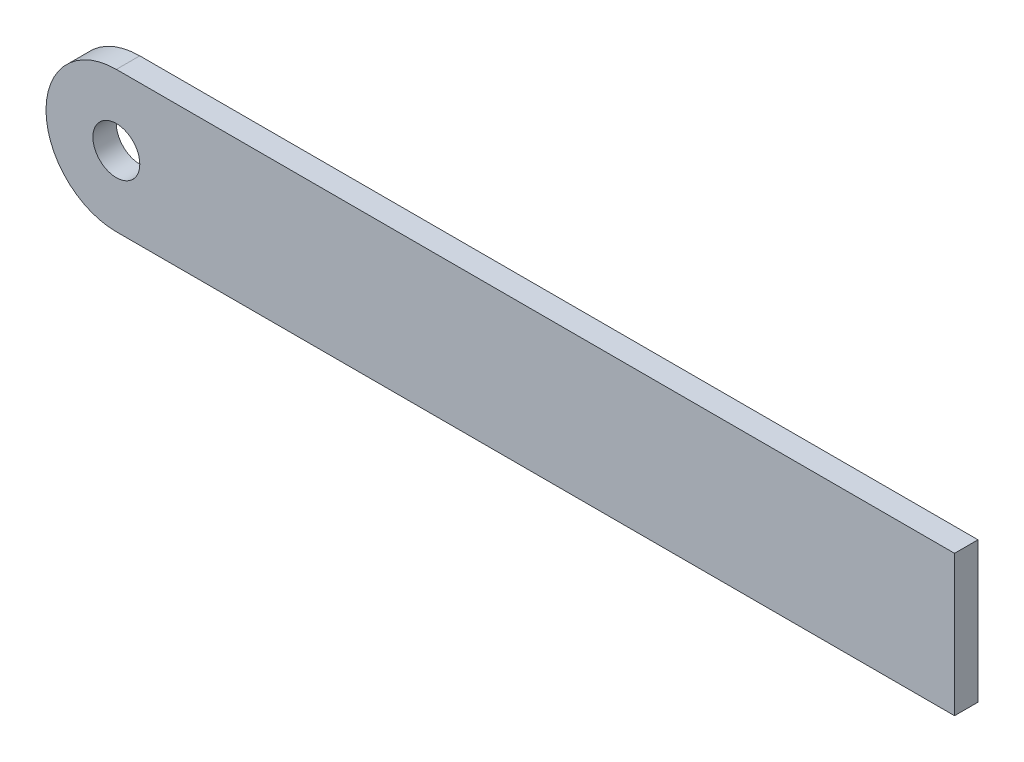
from build123d import *

# Parameters (mm, degrees)
ESQUISSE1_R                  = 2
BOSS_EXTRU_1_DEPTH           = 2
ENL_V_MAT_EXTRU_1_DEPTH      = 78.757636281
ENL_V_MAT_EXTRU_1_DEPTH_BACK = 78.757636281


with BuildPart() as part:
    # Esquisse1 → Boss.-Extru.1 (new body)
    with BuildSketch(Plane.XY):
        with BuildLine():
            Line((-71.5, 6), (71.5, 6))
            ThreePointArc((71.5, 6), (77.5, 0), (71.5, -6))
            Line((71.5, -6), (-71.5, -6))
            ThreePointArc((-71.5, -6), (-77.5, 0), (-71.5, 6))
        make_face()
        with Locations((-71.5, 0)):
            Circle(ESQUISSE1_R, mode=Mode.SUBTRACT)
        with Locations((71.5, 0)):
            Circle(ESQUISSE1_R, mode=Mode.SUBTRACT)
    extrude(amount=BOSS_EXTRU_1_DEPTH)

    # Esquisse3 → Enlèv. mat.-Extru.1 (cut, two sides: drawn at the far end of the back side and taken through both)
    with BuildSketch(Plane.XY.offset(2).offset(-ENL_V_MAT_EXTRU_1_DEPTH_BACK)):
        Polygon((0, 0), (0, 10.962701513), (80.234264698, 10.962701513), (80.234264698, -13.981416423), (0, -13.981416423), align=None)
    extrude(amount=ENL_V_MAT_EXTRU_1_DEPTH + ENL_V_MAT_EXTRU_1_DEPTH_BACK, mode=Mode.SUBTRACT)


solid = part.part
